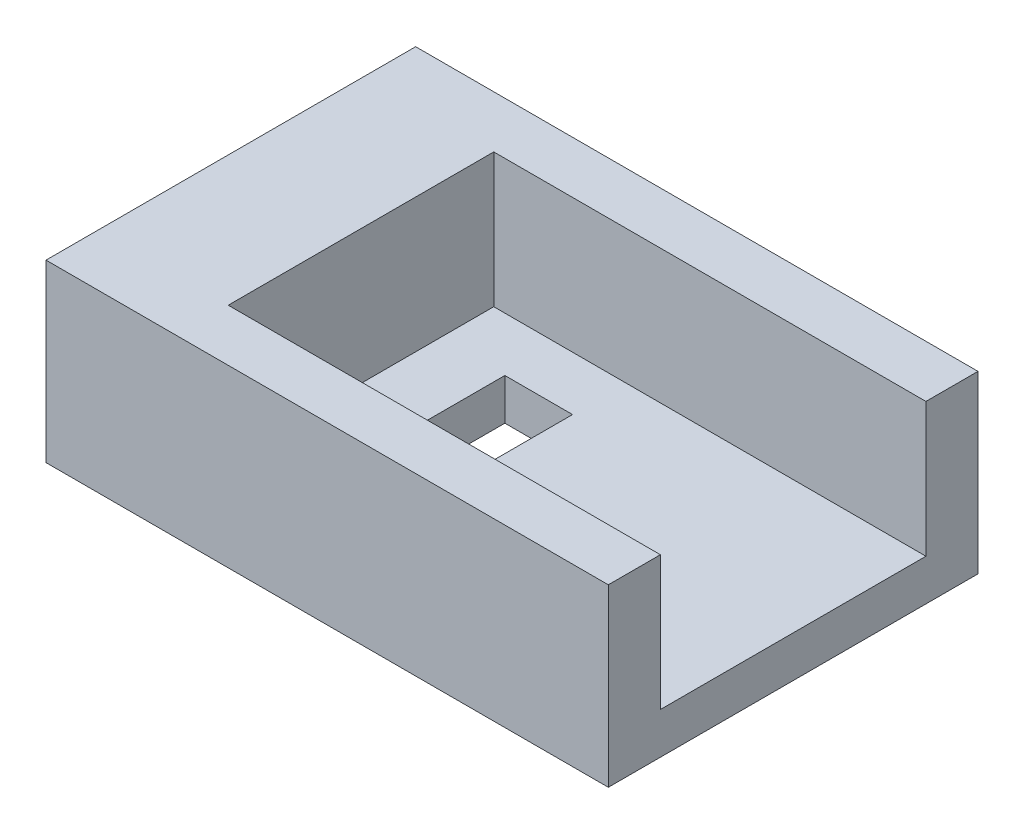
from build123d import *

# Parameters (mm, degrees)
SKETCH1_W           = 43.20032
SKETCH1_H           = 28.39974
BOSS_EXTRUDE1_DEPTH = 13.4747
SKETCH2_W           = 33.20034
SKETCH2_H           = 20.39874
CUT_EXTRUDE1_DEPTH  = 10.2997
SKETCH3_W           = 5.19938
SKETCH3_H           = 12.10056
CUT_EXTRUDE2_DEPTH  = 53.715241631


with BuildPart() as part:
    # Sketch1 → Boss-Extrude1 (new body)
    with BuildSketch(Plane(origin=(0, 0, 0), x_dir=(1, 0, 0), z_dir=(0, 1, 0))):
        with Locations((21.60016, 14.19987)):
            Rectangle(SKETCH1_W, SKETCH1_H)
    extrude(amount=BOSS_EXTRUDE1_DEPTH)

    # Sketch2 → Cut-Extrude1 (cut)
    with BuildSketch(Plane(origin=(0, 13.4747, 0), x_dir=(1, 0, 0), z_dir=(0, 1, 0))):
        with Locations((26.60015, 14.19987)):
            Rectangle(SKETCH2_W, SKETCH2_H)
    extrude(amount=-CUT_EXTRUDE1_DEPTH, mode=Mode.SUBTRACT)

    # Sketch3 → Cut-Extrude2 (cut, through all)
    with BuildSketch(Plane(origin=(0, 3.175, 0), x_dir=(1, 0, 0), z_dir=(0, 1, 0))):
        with Locations((17.60093, 14.19987)):
            Rectangle(SKETCH3_W, SKETCH3_H)
    extrude(amount=-CUT_EXTRUDE2_DEPTH, mode=Mode.SUBTRACT)


solid = part.part
